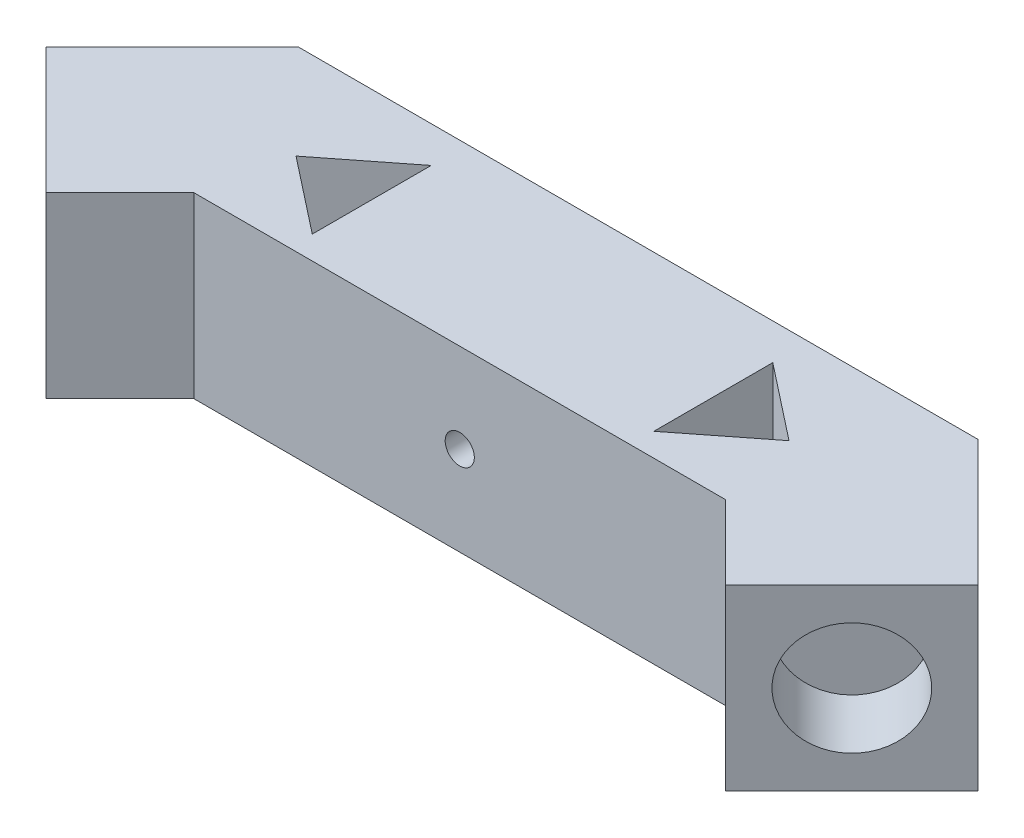
from build123d import *

# Parameters (mm, degrees)
BOSS_EXTRUDE1_DEPTH = 38.1
SKETCH2_R           = 12.065
CUT_EXTRUDE1_DEPTH  = 15.24
SKETCH3_R           = 12.065
CUT_EXTRUDE2_DEPTH  = 15.24
CUT_EXTRUDE3_DEPTH  = 38.1
SKETCH6_R           = 3.1115
CUT_EXTRUDE4_DEPTH  = 46.482


with BuildPart() as part:
    # Sketch1 → Boss-Extrude1 (new body)
    with BuildSketch(Plane(origin=(0, 0, 0), x_dir=(1, 0, 0), z_dir=(0, 1, 0))):
        Polygon((0, 0), (113.579665808, 0), (129.361202535, -15.781536726), (156.301970898, 11.159231637), (129.361202535, 38.1), (-15.781536726, 38.1), (-42.72230509, 11.159231637), (-15.781536726, -15.781536726), align=None)
    extrude(amount=BOSS_EXTRUDE1_DEPTH)

    # Sketch2 → Cut-Extrude1 (cut)
    with BuildSketch(Plane(origin=(-15.781536726, 0, 15.781536726), x_dir=(0.7071067811865477, 0, 0.7071067811865475), z_dir=(-0.7071067811865475, 0, 0.7071067811865477))):
        with Locations((-19.05, 19.05)):
            Circle(SKETCH2_R)
    extrude(amount=-CUT_EXTRUDE1_DEPTH, mode=Mode.SUBTRACT)

    # Sketch3 → Cut-Extrude2 (cut)
    with BuildSketch(Plane(origin=(72.57136963, 0, 72.57136963), x_dir=(0.7071067811865478, 0, -0.7071067811865474), z_dir=(0.7071067811865474, 0, 0.7071067811865478))):
        with Locations((99.362951898, 19.05)):
            Circle(SKETCH3_R)
    extrude(amount=-CUT_EXTRUDE2_DEPTH, mode=Mode.SUBTRACT)

    # Sketch5 → Cut-Extrude3 (cut)
    with BuildSketch(Plane(origin=(0, 38.1, 0), x_dir=(1, 0, 0), z_dir=(0, 1, 0))):
        Polygon((4.151555437, 17.676821295), (20.32, 30.376821295), (20.32, 4.976821295), align=None)
        Polygon((93.259665808, 30.376821295), (93.259665808, 4.976821295), (109.428110371, 17.676821295), align=None)
    extrude(amount=-CUT_EXTRUDE3_DEPTH, mode=Mode.SUBTRACT)

    # Sketch6 → Cut-Extrude4 (cut)
    with BuildSketch(Plane(origin=(0, 0, -38.1), x_dir=(-1, 0, 0), z_dir=(0, 0, -1))):
        with Locations((-56.789832904, 19.05)):
            Circle(SKETCH6_R)
    extrude(amount=-CUT_EXTRUDE4_DEPTH, mode=Mode.SUBTRACT)


solid = part.part
